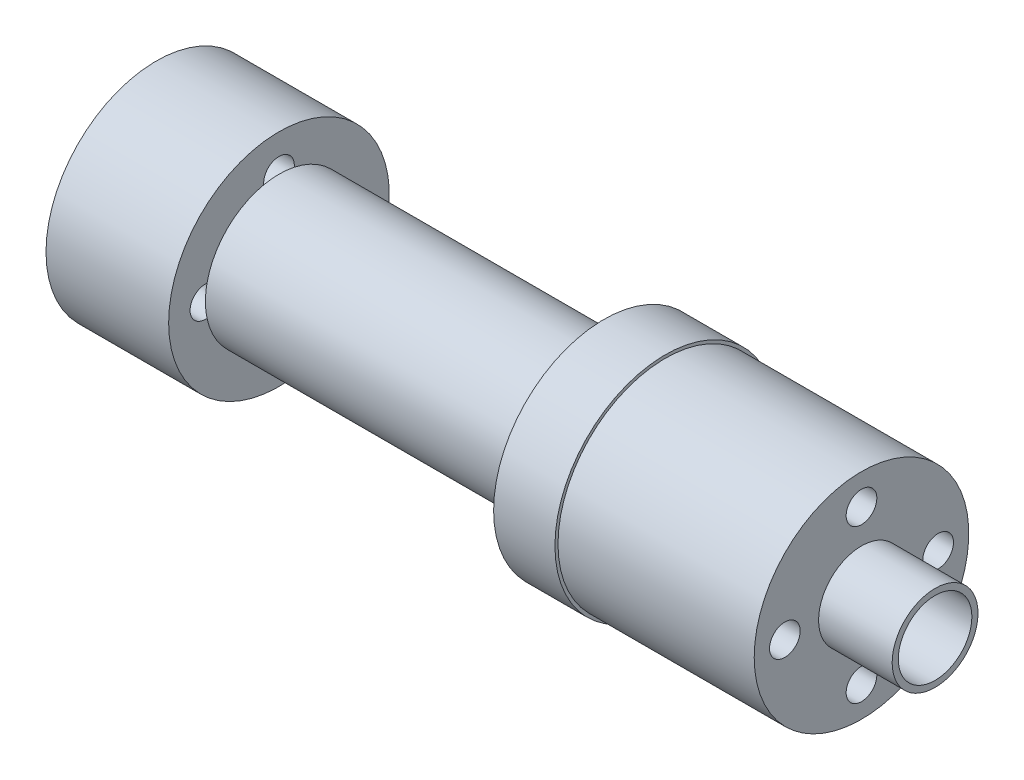
from build123d import *

# Parameters (mm, degrees)
HOLE_WIZARD_M3_1_D     = 2.5
HOLE_WIZARD_M3_1_DEPTH = 10
HOLE_WIZARD_M3_2_D     = 2.5
HOLE_WIZARD_M3_2_DEPTH = 9.5
HOLE_WIZARD_M3_2_TIP   = 0.751075774
EXTRUDE_START          = 6
SKETCH_9_R             = 3.5
SKETCH_9_R_2           = 3
EXTRUDE_1_DEPTH        = 6


with BuildPart() as part:
    # 草图1 → 旋转1 (revolve)
    with BuildSketch(Plane.XY, mode=Mode.PRIVATE) as revolve_1_sk:
        Polygon((0, 9), (0, 3), (57.5, 3), (57.5, 8.75), (41.5, 8.75), (41.5, 9), (36.5, 9), (36.5, 6), (10, 6), (10, 9), align=None)
    revolve(revolve_1_sk.sketch.rotate(Axis((0, 0, 0), (1, 0, 0)), 90), axis=Axis((0, 0, 0), (1, 0, 0)))

    # M3 螺纹孔1
    with Locations(Plane.ZY):
        with Locations((0, 6), (6, 0), (0, -6), (-6, 0)):
            Hole(HOLE_WIZARD_M3_1_D / 2, depth=HOLE_WIZARD_M3_1_DEPTH)

    # M3 螺纹孔2
    with Locations(Plane(origin=(57.5, 0, 0), x_dir=(0, 0, -1), z_dir=(1, 0, 0))):
        with Locations((0, 6.25), (6.25, 0), (0, -6.25), (-6.25, 0)):
            Hole(HOLE_WIZARD_M3_2_D / 2, depth=HOLE_WIZARD_M3_2_DEPTH)
            with Locations((0, 0, -(HOLE_WIZARD_M3_2_DEPTH + HOLE_WIZARD_M3_2_TIP / 2))):  # 118° drill point
                Cone(0, HOLE_WIZARD_M3_2_D / 2, HOLE_WIZARD_M3_2_TIP, mode=Mode.SUBTRACT)

    # 草图9 → 凸台-拉伸1 (add)
    with BuildSketch(Plane(origin=(57.5, 0, 0), x_dir=(0, 0, -1), z_dir=(1, 0, 0)).offset(EXTRUDE_START)):
        with Locations(Location((0, 0, 0), (0, 0, 180))):
            Circle(SKETCH_9_R)
        with Locations(Location((0, 0, 0), (0, 0, 180))):
            Circle(SKETCH_9_R_2, mode=Mode.SUBTRACT)
    extrude(amount=-EXTRUDE_1_DEPTH)


solid = part.part
